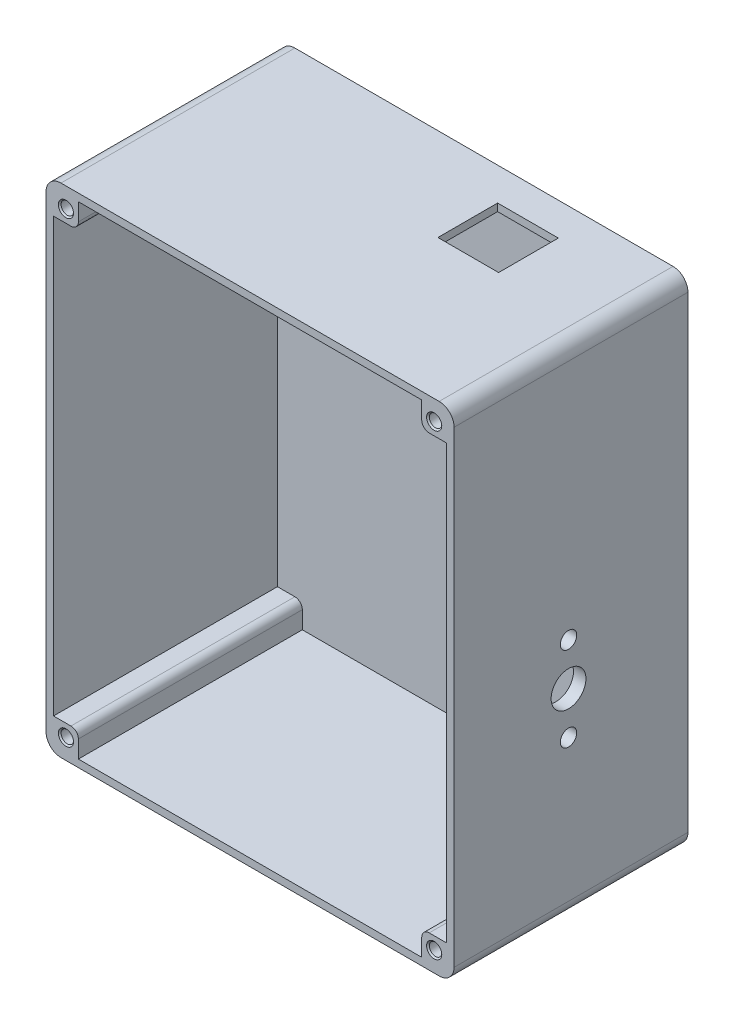
from build123d import *

# Parameters (mm, degrees)
SKETCH_2_W                  = 82
SKETCH_2_H                  = 100
EXTRUDE_1_DEPTH             = 2
SKETCH_9_W                  = 82
SKETCH_9_H                  = 100
EXTRUDE_4_DEPTH             = 45
SKETCH_10_R                 = 2.25
EXTRUDE_5_DEPTH             = 3
M3_TAPPED_HOLE1_D           = 2.5
M3_TAPPED_HOLE1_CSINK_D     = 3.05
M3_TAPPED_HOLE1_CSINK_ANGLE = 90
CUT_EXTRUDE_2_REACH         = 138.511
SKETCH_14_W                 = 12.2
SKETCH_14_H                 = 12
CUT_EXTRUDE_3_REACH         = 139.597
SKETCH_16_R                 = 3.5
SKETCH_16_R_2               = 1.65
SKETCH_17_W                 = 26
SKETCH_17_H                 = 26
SKETCH_17_R                 = 1.65
SKETCH_17_R_2               = 3.5
EXTRUDE_6_DEPTH             = 1
M3_TAPPED_HOLE3_D           = 2.5
M3_TAPPED_HOLE3_CSINK_D     = 3.05
M3_TAPPED_HOLE3_CSINK_ANGLE = 90
FILLET_2_R                  = 3
FILLET_3_R                  = 1.5


with BuildPart() as part:
    # 草图2 → 凸台-拉伸1 (new body)
    with BuildSketch(Plane.XY):
        with Locations((41, -50)):
            Rectangle(SKETCH_2_W, SKETCH_2_H)
    extrude(amount=EXTRUDE_1_DEPTH)

    # 草图9 → 凸台-拉伸4 (add)
    with BuildSketch(Plane.XY.offset(2)):
        with Locations((41, -50)):
            Rectangle(SKETCH_9_W, SKETCH_9_H)
        Polygon((80.5, -6.5), (75.5, -6.5), (75.5, -1.5), (6.5, -1.5), (6.5, -6.5), (1.5, -6.5), (1.5, -93.5), (6.5, -93.5), (6.5, -98.5), (75.5, -98.5), (75.5, -93.5), (80.5, -93.5), align=None, mode=Mode.SUBTRACT)
    extrude(amount=EXTRUDE_4_DEPTH)

    # 草图10 → 凸台-拉伸5 (add)
    with BuildSketch(Plane.XY.offset(2)):
        with Locations((15, -6)):
            Circle(SKETCH_10_R)
        with Locations((67, -6)):
            Circle(SKETCH_10_R)
        with Locations((67, -38)):
            Circle(SKETCH_10_R)
        with Locations((15, -38)):
            Circle(SKETCH_10_R)
    extrude(amount=EXTRUDE_5_DEPTH)

    # M3 Tapped Hole1 (through all)
    with Locations(Plane.XY.offset(5)):
        with Locations((67, -6), (67, -38), (15, -38), (15, -6)):
            CounterSinkHole(M3_TAPPED_HOLE1_D / 2, M3_TAPPED_HOLE1_CSINK_D / 2, counter_sink_angle=M3_TAPPED_HOLE1_CSINK_ANGLE)

    # 草图14 → 切除-拉伸2 (cut, up to next)
    with BuildSketch(Plane.XZ.offset(1.5), mode=Mode.PRIVATE) as cut_extrude_2_sk1:
        with Locations((56.45, 12.6)):
            Rectangle(SKETCH_14_W, SKETCH_14_H)
    cut_extrude_2_tool1 = extrude(cut_extrude_2_sk1.sketch, amount=-CUT_EXTRUDE_2_REACH, mode=Mode.PRIVATE) & part.part
    add(cut_extrude_2_tool1.solids().sort_by_distance((56.45, -1.5, 12.6))[0], mode=Mode.SUBTRACT)

    # 草图16 → 切除-拉伸3 (cut, up to next)
    with BuildSketch(Plane(origin=(82, 0, 0), x_dir=(0, 0, -1), z_dir=(1, 0, 0)), mode=Mode.PRIVATE) as cut_extrude_3_sk1:
        with Locations((-24, -60)):
            Circle(SKETCH_16_R)
    cut_extrude_3_tool1 = extrude(cut_extrude_3_sk1.sketch, amount=-CUT_EXTRUDE_3_REACH, mode=Mode.PRIVATE) & part.part
    # 草图16 → 切除-拉伸3 (cut, up to next)
    with BuildSketch(Plane(origin=(82, 0, 0), x_dir=(0, 0, -1), z_dir=(1, 0, 0)), mode=Mode.PRIVATE) as cut_extrude_3_sk2:
        with Locations((-24, -51.5)):
            Circle(SKETCH_16_R_2)
    cut_extrude_3_tool2 = extrude(cut_extrude_3_sk2.sketch, amount=-CUT_EXTRUDE_3_REACH, mode=Mode.PRIVATE) & part.part
    # 草图16 → 切除-拉伸3 (cut, up to next)
    with BuildSketch(Plane(origin=(82, 0, 0), x_dir=(0, 0, -1), z_dir=(1, 0, 0)), mode=Mode.PRIVATE) as cut_extrude_3_sk3:
        with Locations(Location((-24, -68.5, 0), (0, 0, 270))):
            Circle(SKETCH_16_R_2)
    cut_extrude_3_tool3 = extrude(cut_extrude_3_sk3.sketch, amount=-CUT_EXTRUDE_3_REACH, mode=Mode.PRIVATE) & part.part
    add(cut_extrude_3_tool1.solids().sort_by_distance((82, -60, 24))[0], mode=Mode.SUBTRACT)
    add(cut_extrude_3_tool2.solids().sort_by_distance((82, -51.5, 24))[0], mode=Mode.SUBTRACT)
    add(cut_extrude_3_tool3.solids().sort_by_distance((82, -68.5, 24))[0], mode=Mode.SUBTRACT)

    # 草图17 → 凸台-拉伸6 (add)
    with BuildSketch(Plane.ZY.offset(-80.5)):
        with Locations((24, -60)):
            Rectangle(SKETCH_17_W, SKETCH_17_H)
        with Locations(Location((24, -51.5, 0), (0, 0, 180))):
            Circle(SKETCH_17_R, mode=Mode.SUBTRACT)
        with Locations(Location((24, -60, 0), (0, 0, 180))):
            Circle(SKETCH_17_R_2, mode=Mode.SUBTRACT)
        with Locations((24, -68.5)):
            Circle(SKETCH_17_R, mode=Mode.SUBTRACT)
    extrude(amount=EXTRUDE_6_DEPTH)

    # M3 Tapped Hole3 (through all)
    with Locations(Plane.XY.offset(47)):
        with Locations((4, -4), (4, -96), (78, -96), (78, -4)):
            CounterSinkHole(M3_TAPPED_HOLE3_D / 2, M3_TAPPED_HOLE3_CSINK_D / 2, counter_sink_angle=M3_TAPPED_HOLE3_CSINK_ANGLE)

    # 圆角2
    fillet_2_edges = [part.edges().sort_by_distance(p)[0] for p in [
        (82, -100, 23.5),
        (0, -100, 23.5),
        (0, 0, 23.5),
        (82, 0, 23.5),
    ]]
    fillet(fillet_2_edges, radius=FILLET_2_R)

    # 圆角3
    fillet_3_edges = [part.edges().sort_by_distance(p)[0] for p in [
        (6.5, -6.5, 24.5),
        (6.5, -93.5, 24.5),
        (75.5, -93.5, 24.5),
        (75.5, -6.5, 24.5),
    ]]
    fillet(fillet_3_edges, radius=FILLET_3_R)


solid = part.part
